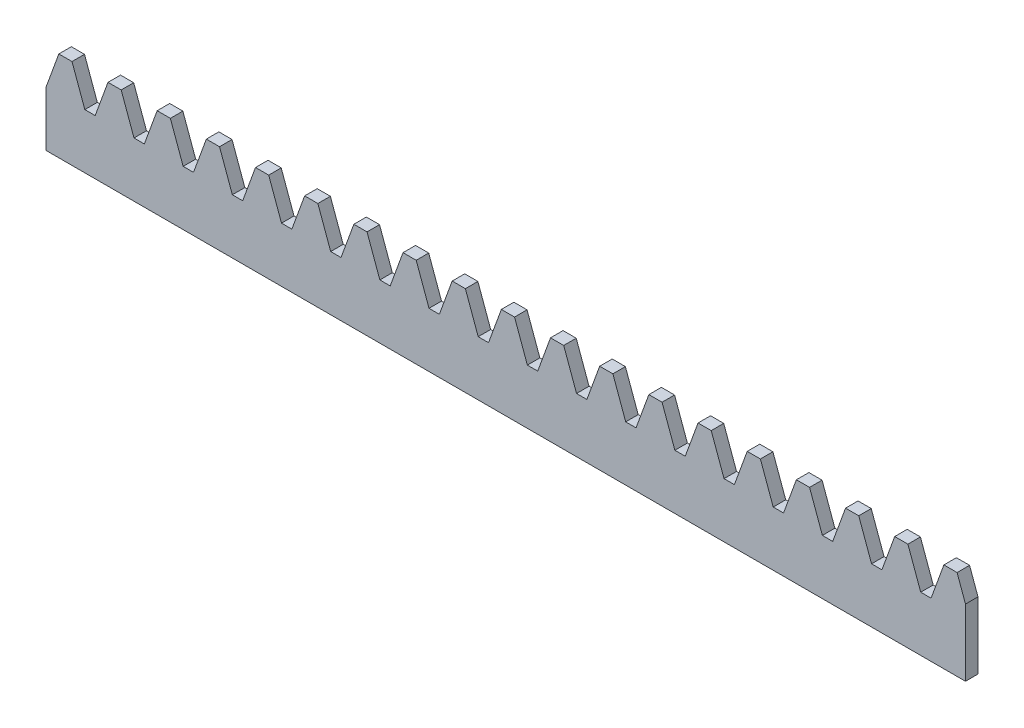
from build123d import *

# Parameters (mm, degrees)
SKETCH_1_W             = 94.247779608
SKETCH_1_H             = 10
EXTRUDE_1_DEPTH        = 30
EXTRUDE_2_DEPTH        = 30
PATTERN_LINEAR_1_COUNT = 30
PATTERN_LINEAR_1_PITCH = 3.141592654
SKETCH_3_W             = 127.719495272
SKETCH_3_H             = 47.772940979
CUT_EXTRUDE_1_DEPTH    = 29.2
SKETCH_4_W             = 116.864963103
SKETCH_4_H             = 41.403215516
CUT_EXTRUDE_2_DEPTH    = 6.5
SKETCH_5_W             = 7.796889188
SKETCH_5_H             = 8.147498767
CUT_EXTRUDE_3_DEPTH    = 35.5


with BuildPart() as part:
    # 草图1 → 拉伸1 (new body)
    with BuildSketch(Plane.XY):
        with Locations((47.123889804, -5)):
            Rectangle(SKETCH_1_W, SKETCH_1_H)
    extrude(amount=EXTRUDE_1_DEPTH)

    # 草图2 → 拉伸2 (add)
    with BuildSketch(Plane.XY.offset(30)):
        Polygon((0, 0), (0.818933027, 2.25), (1.661788885, 2.25), (2.480721912, 0), align=None)
    extrude_2 = extrude(amount=-EXTRUDE_2_DEPTH)

    # 阵列(线性)1: 拉伸2 ×30
    with Locations(*[(i * PATTERN_LINEAR_1_PITCH, 0, 0) for i in range(1, PATTERN_LINEAR_1_COUNT)]):
        add(extrude_2)

    # 草图3 → 切除-拉伸1 (cut)
    with BuildSketch(Plane.XY.offset(30)):
        with Locations((51.771189505, -6.332442571)):
            Rectangle(SKETCH_3_W, SKETCH_3_H)
    extrude(amount=-CUT_EXTRUDE_1_DEPTH, mode=Mode.SUBTRACT)

    # 草图4 → 切除-拉伸2 (cut)
    with BuildSketch(Plane.XZ.offset(10)):
        with Locations((50.698735728, -1.072453777)):
            Rectangle(SKETCH_4_W, SKETCH_4_H)
    extrude(amount=-CUT_EXTRUDE_2_DEPTH, mode=Mode.SUBTRACT)

    # 草图5 → 切除-拉伸3 (cut)
    with BuildSketch(Plane(origin=(94.247779608, 0, 0), x_dir=(0, 0, -1), z_dir=(1, 0, 0))):
        with Locations((-0.132848354, -1.658756065)):
            Rectangle(SKETCH_5_W, SKETCH_5_H)
    extrude(amount=-CUT_EXTRUDE_3_DEPTH, mode=Mode.SUBTRACT)


solid = part.part
